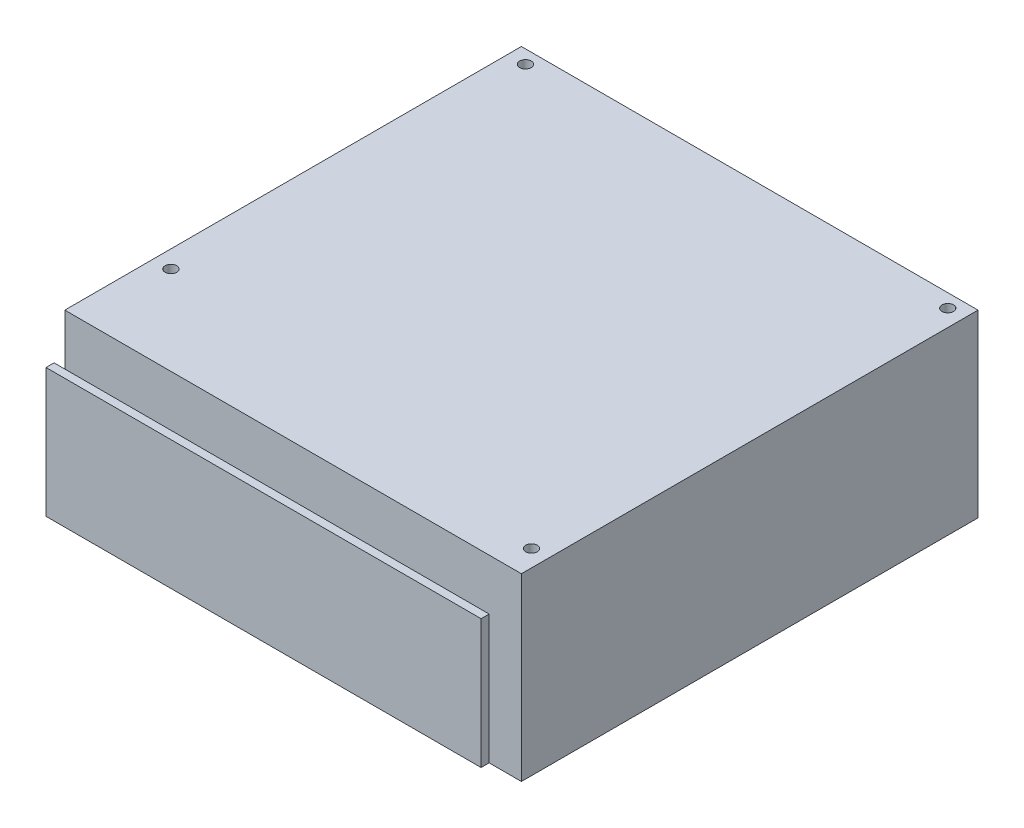
from build123d import *

# Parameters (mm, degrees)
SKETCH1_W            = 170
SKETCH1_H            = 170
BOSS_EXTRUDE1_DEPTH  = 67
SKETCH2_W            = 162
SKETCH2_H            = 48
BOSS_EXTRUDE2_DEPTH  = 3
M4_CLEARANCE_HOLE1_D = 4.3


with BuildPart() as part:
    # Sketch1 → Boss-Extrude1 (new body)
    with BuildSketch(Plane(origin=(0, 0, 0), x_dir=(1, 0, 0), z_dir=(0, 1, 0))):
        Rectangle(SKETCH1_W, SKETCH1_H)
    extrude(amount=BOSS_EXTRUDE1_DEPTH)

    # Sketch2 → Boss-Extrude2 (add)
    with BuildSketch(Plane.XY.offset(85)):
        with Locations((-8, 24)):
            Rectangle(SKETCH2_W, SKETCH2_H)
    extrude(amount=BOSS_EXTRUDE2_DEPTH)

    # M4 Clearance Hole1 (through all)
    with Locations(Plane(origin=(0, 67, 0), x_dir=(1, 0, 0), z_dir=(0, 1, 0))):
        with Locations((-78.5, 80), (-78.5, -52), (78.75, -75), (78.75, 80)):
            Hole(M4_CLEARANCE_HOLE1_D / 2)


solid = part.part
